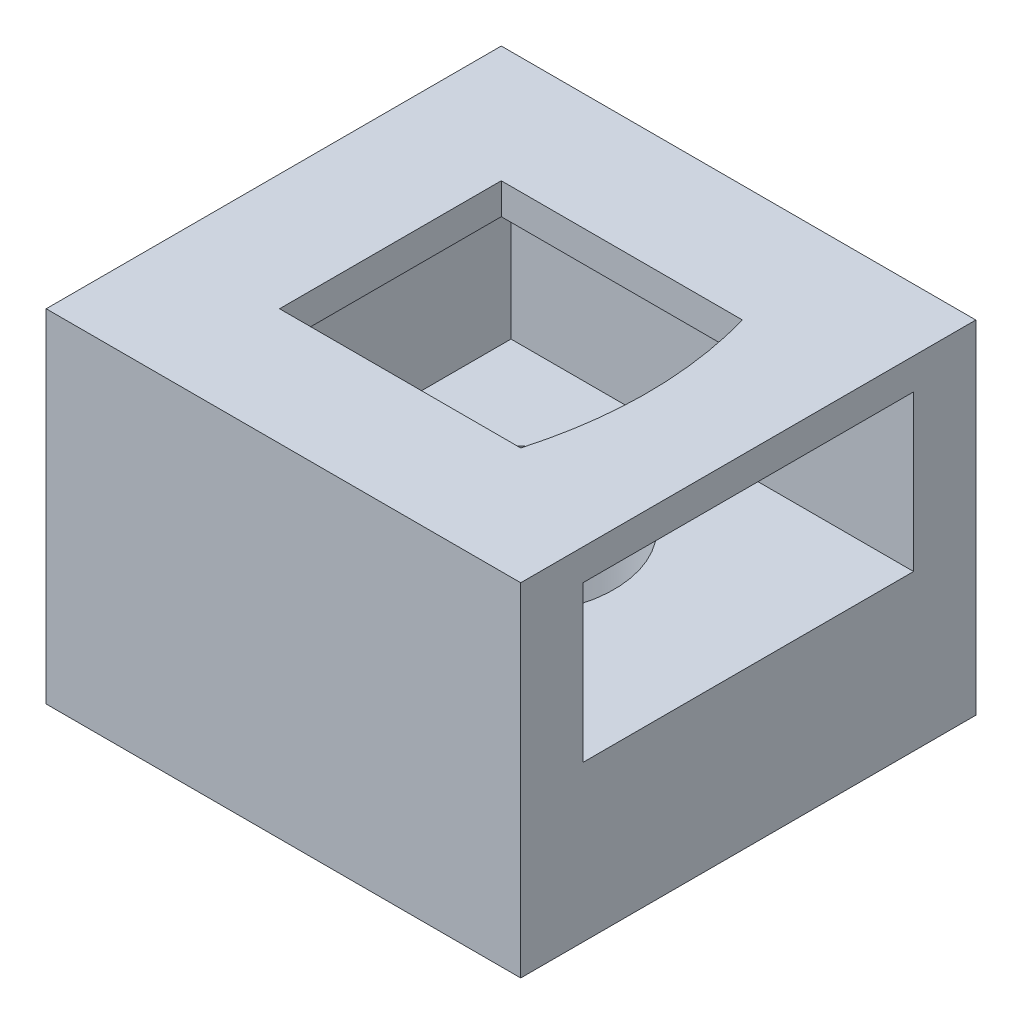
from build123d import *

# Parameters (mm, degrees)
SKETCH2_W           = 12.2
SKETCH2_H           = 11.7
SKETCH2_W_2         = 6.2
SKETCH2_H_2         = 5.7
BOSS_EXTRUDE1_DEPTH = 0.8
SKETCH3_W           = 12.2
SKETCH3_H           = 11.7
SKETCH3_W_2         = 8.5
SKETCH3_H_2         = 8.5
BOSS_EXTRUDE2_DEPTH = 4
SKETCH4_W           = 12.2
SKETCH4_H           = 11.7
SKETCH4_R           = 2.65
BOSS_EXTRUDE3_DEPTH = 4
SKETCH5_W           = 2.5
SKETCH5_H           = 2.5
BOSS_EXTRUDE4_DEPTH = 6.22
SKETCH8_W           = 8.5
SKETCH8_H           = 4
CUT_EXTRUDE2_DEPTH  = 6.22
CUT_EXTRUDE3_DEPTH  = 2


with BuildPart() as part:
    # Sketch2 → Boss-Extrude1 (new body)
    with BuildSketch(Plane(origin=(0, 0, 0), x_dir=(1, 0, 0), z_dir=(0, 1, 0))):
        Rectangle(SKETCH2_W, SKETCH2_H)
        Rectangle(SKETCH2_W_2, SKETCH2_H_2, mode=Mode.SUBTRACT)
    extrude(amount=-BOSS_EXTRUDE1_DEPTH)

    # Sketch3 → Boss-Extrude2 (add)
    with BuildSketch(Plane.XZ.offset(0.8)):
        Rectangle(SKETCH3_W, SKETCH3_H)
        Rectangle(SKETCH3_W_2, SKETCH3_H_2, mode=Mode.SUBTRACT)
    extrude(amount=BOSS_EXTRUDE2_DEPTH)

    # Sketch4 → Boss-Extrude3 (add)
    with BuildSketch(Plane.XZ.offset(4.8)):
        Rectangle(SKETCH4_W, SKETCH4_H)
        with Locations(Location((0, 0, 0), (0, 0, 270))):
            Circle(SKETCH4_R, mode=Mode.SUBTRACT)
    extrude(amount=BOSS_EXTRUDE3_DEPTH)

    # Sketch5 → Boss-Extrude4 (add)
    with BuildSketch(Plane.XZ.offset(8.8)):
        with Locations((-4.85, -4.6)):
            Rectangle(SKETCH5_W, SKETCH5_H)
    extrude(amount=BOSS_EXTRUDE4_DEPTH)

    # Sketch8 → Cut-Extrude2 (cut)
    with BuildSketch(Plane.ZY.offset(-4.25)):
        with Locations((0, -2.8)):
            Rectangle(SKETCH8_W, SKETCH8_H)
    extrude(amount=-CUT_EXTRUDE2_DEPTH, mode=Mode.SUBTRACT)

    # Sketch9 → Cut-Extrude3 (cut)
    with BuildSketch(Plane(origin=(0, 0, 0), x_dir=(1, 0, 0), z_dir=(0, 1, 0))):
        with BuildLine():
            Line((3.1, 2.85), (3.1, -2.85))
            add(Edge.make_bspline(
                [(3.1, 2.85), (3.9, 0), (3.1, -2.85)],
                knots=[0, 0, 0, 1, 1, 1], degree=2))
        make_face()
    extrude(amount=-CUT_EXTRUDE3_DEPTH, mode=Mode.SUBTRACT)


solid = part.part
